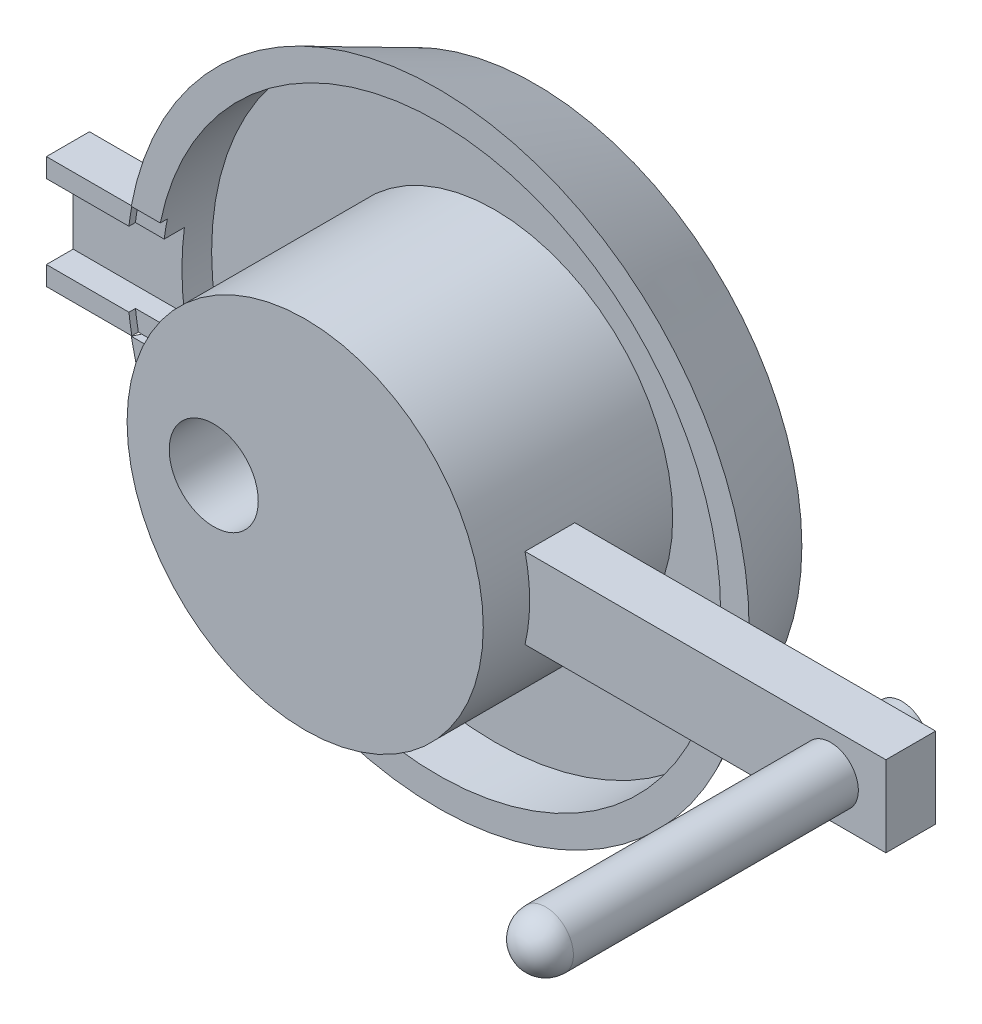
from build123d import *

# Parameters (mm, degrees)
SKETCH_1_R               = 50
EXTRUDE_1_DEPTH          = 20
SKETCH_4_R               = 12.5
CUT_EXTRUDE_1_DEPTH      = 40
EXTRUDE_2_REACH          = 115.578
EXTRUDE_2_END_RADIUS     = 50
SKETCH_5_W               = 13.960137626
SKETCH_5_H               = 22.640061842
SKETCH_6_W               = 13.960137626
SKETCH_6_H               = 22.640061842
EXTRUDE_3_DEPTH          = 100
EXTRUDE_4_DEPTH          = 80
EXTRUDE_4_DEPTH_BACK     = 20
SKETCH_7_R               = 7.782320826
SKETCH_13_R              = 79.451687304
CUT_EXTRUDE_2_DEPTH      = 16
SKETCH_14_R              = 50
EXTRUDE_5_DEPTH          = 16
SKETCH_17_W              = 12.089731424
SKETCH_17_H              = 31.60601215
EXTRUDE_6_DEPTH          = 50
CUT_EXTRUDE_3_DEPTH      = 15.831035086
CUT_EXTRUDE_4_REACH      = 292.221
CUT_EXTRUDE_4_END_RADIUS = 79.451687304
SKETCH_25_W              = 7.503169627
SKETCH_25_H              = 20.882263368
CUT_EXTRUDE_5_DEPTH      = 2
SKETCH_27_W              = 13.960137626
SKETCH_27_H              = 22.640061842
EXTRUDE_7_DEPTH          = 40


with BuildPart() as part:
    # 草图1 → 凸台-拉伸1 (new, symmetric)
    with BuildSketch(Plane.XY):
        Circle(SKETCH_1_R)
    extrude(amount=EXTRUDE_1_DEPTH, both=True)

    # 草图4 → 切除-拉伸1 (cut)
    with BuildSketch(Plane.XY.offset(20)):
        with Locations((-25.673554091, -0.852792881)):
            Circle(SKETCH_4_R)
    extrude(amount=-CUT_EXTRUDE_1_DEPTH, mode=Mode.SUBTRACT)

    # 凸台-拉伸2: up to this cylinder (the profile starts outside it)
    extrude_2_end = Plane(origin=(0, 0, 0), z_dir=(0, 0, -1)) * Cylinder(EXTRUDE_2_END_RADIUS, 332.156, mode=Mode.PRIVATE)
    # 草图5 → 凸台-拉伸2 (add, up to the surface)
    with BuildSketch(Plane(origin=(50, 0, 0), x_dir=(0, 0, -1), z_dir=(1, 0, 0)), mode=Mode.PRIVATE) as extrude_2_sk1:
        Rectangle(SKETCH_5_W, SKETCH_5_H)
    extrude_2_tool1 = extrude(extrude_2_sk1.sketch, amount=-EXTRUDE_2_REACH, mode=Mode.PRIVATE) - extrude_2_end
    add(extrude_2_tool1.solids().sort_by_distance((50, 0, 0))[0])
    add(extrude_2_tool1.solids().sort_by_distance((50, 0, 0))[1])

    # 草图6 → 凸台-拉伸3 (add)
    with BuildSketch(Plane(origin=(50, 0, 0), x_dir=(0, 0, -1), z_dir=(1, 0, 0))):
        Rectangle(SKETCH_6_W, SKETCH_6_H)
    extrude(amount=EXTRUDE_3_DEPTH)

    # 草图7 → 凸台-拉伸4 (add, two sides: drawn at the far end of the back side and taken through both)
    with BuildSketch(Plane.XY.offset(6.980068813).offset(-EXTRUDE_4_DEPTH_BACK)):
        with Locations((134.496533675, 0)):
            Circle(SKETCH_7_R)
    extrude(amount=EXTRUDE_4_DEPTH + EXTRUDE_4_DEPTH_BACK)

    # 草图8 → 旋转1 (revolve)
    with BuildSketch(Plane.XY.offset(86.980068813)):
        with BuildLine():
            Line((126.714212849, 0), (142.278854501, 0))
            ThreePointArc((142.278854501, 0), (134.496533675, -7.782320826), (126.714212849, 0))
        make_face()
    revolve(axis=Axis((126.714212849, 0, 86.980068813), (1, 0, 0)))

    # 草图10 → 旋转2 (revolve)
    with BuildSketch(Plane(origin=(0, 0, 0), x_dir=(1, 0, 0), z_dir=(0, 1, 0))):
        Polygon((0, 20), (0, 44.4833931), (74.95212992, 44.4833931), (87.453253564, 17.178307248), (50, 17.178307248), (50, 20), align=None)
    revolve(axis=Axis((0, 0, -20), (0, 0, -1)))

    # 草图13 → 切除-拉伸2 (cut)
    with BuildSketch(Plane.XY.offset(-17.178307248)):
        Circle(SKETCH_13_R)
    extrude(amount=-CUT_EXTRUDE_2_DEPTH, mode=Mode.SUBTRACT)


with BuildPart() as cut_extrude_2_piece_1:
    # of the separate pieces the step leaves, piece 1, a body of its own (cut_extrude_2_pieces)
    add(part.part.solids().sort_by_distance((50, 0, -17.178307248))[0])



with BuildPart() as cut_extrude_2_piece_2:
    # of the separate pieces the step leaves, piece 2, a body of its own (cut_extrude_2_pieces)
    add(part.part.solids().sort_by_distance((87.453253564, 0, -17.178307248))[0])


with BuildPart() as cut_extrude_2_piece_1_1:
    add(cut_extrude_2_piece_1.part)

    add(cut_extrude_2_piece_2.part)  # 凸台-拉伸5 merges 切除-拉伸2 piece 2
    # 草图14 → 凸台-拉伸5 (add)
    with BuildSketch(Plane.XY.offset(-33.178307248)):
        Circle(SKETCH_14_R)
    extrude(amount=EXTRUDE_5_DEPTH)

    # 草图17 → 凸台-拉伸6 (add)
    with BuildSketch(Plane.ZY.offset(60)):
        with Locations((-23.392137874, 0)):
            Rectangle(SKETCH_17_W, SKETCH_17_H)
    extrude(amount=EXTRUDE_6_DEPTH)

    # 草图18 → 切除-拉伸3 (cut)
    with BuildSketch(Plane.XY.offset(-17.347272162)):
        with BuildLine():
            Line((-77.864212669, 15.803006075), (-60, 15.803006075))
            Line((-60, 15.803006075), (-60, -15.803006075))
            Line((-60, -15.803006075), (-77.864212669, -15.803006075))
            ThreePointArc((-77.864212669, -15.803006075), (-79.451687304, 0), (-77.864212669, 15.803006075))
        make_face()
    extrude(amount=-CUT_EXTRUDE_3_DEPTH, mode=Mode.SUBTRACT)

    # 切除-拉伸4: up to this cylinder (the profile starts outside it)
    cut_extrude_4_end = Plane(origin=(0, 0, -21.098857), z_dir=(0, 0, 1)) * Cylinder(CUT_EXTRUDE_4_END_RADIUS, 744.345374609, mode=Mode.PRIVATE)
    # 草图25 → 切除-拉伸4 (cut, up to the surface)
    with BuildSketch(Plane.ZY.offset(110), mode=Mode.PRIVATE) as cut_extrude_4_sk1:
        with Locations((-21.098856975, 0)):
            Rectangle(SKETCH_25_W, SKETCH_25_H)
    cut_extrude_4_tool1 = extrude(cut_extrude_4_sk1.sketch, amount=-CUT_EXTRUDE_4_REACH, mode=Mode.PRIVATE) - cut_extrude_4_end
    add(cut_extrude_4_tool1.solids().sort_by_distance((-110, 0, -21.098857))[0], mode=Mode.SUBTRACT)

    # 草图26 → 切除-拉伸5 (cut)
    with BuildSketch(Plane.XY.offset(-17.178307248)):
        with BuildLine():
            Line((-86.012727773, 15.807663329), (-77.863267306, 15.807663329))
            ThreePointArc((-77.863267306, 15.807663329), (-79.451687304, 0), (-77.863267306, -15.807663329))
            Line((-77.863267306, -15.807663329), (-86.012727773, -15.807663329))
            ThreePointArc((-86.012727773, -15.807663329), (-87.453253564, 0), (-86.012727773, 15.807663329))
        make_face()
    extrude(amount=-CUT_EXTRUDE_5_DEPTH, mode=Mode.SUBTRACT)

    # 草图27 → 凸台-拉伸7 (add)
    with BuildSketch(Plane(origin=(50, 0, 0), x_dir=(0, 0, -1), z_dir=(1, 0, 0))):
        Rectangle(SKETCH_27_W, SKETCH_27_H)
    extrude(amount=-EXTRUDE_7_DEPTH)


solid = cut_extrude_2_piece_1_1.part
